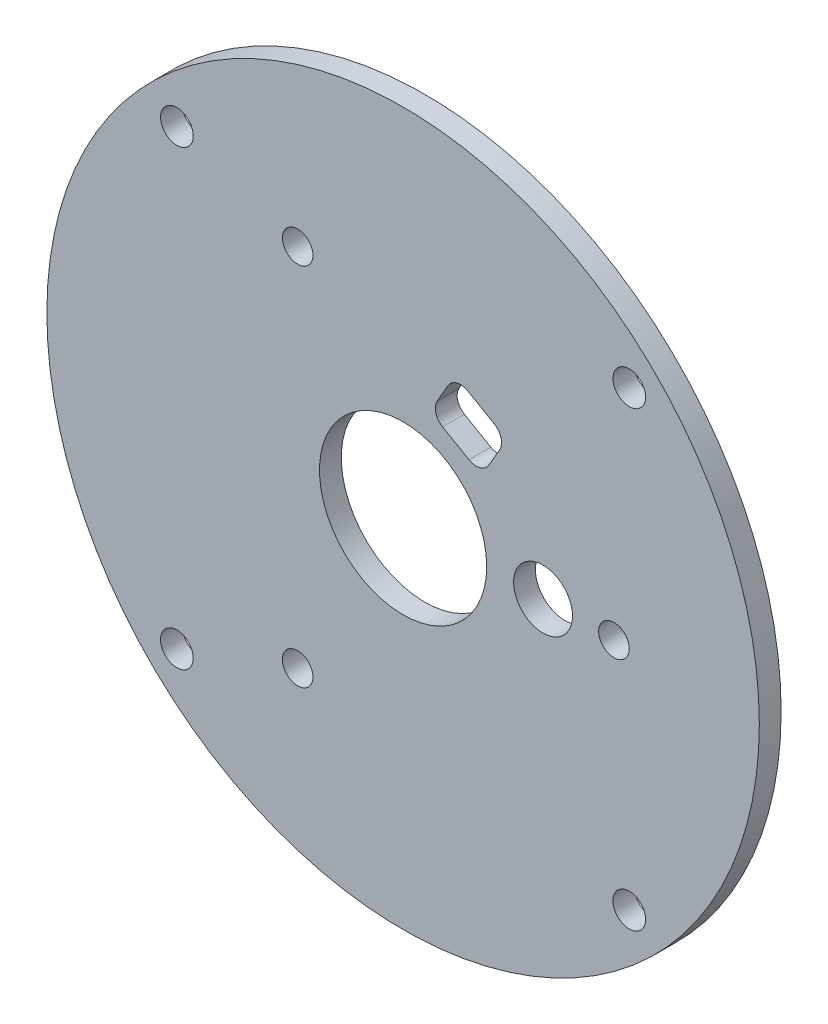
from build123d import *

# Parameters (mm, degrees)
SKETCH_1_R          = 1.6
EXTRUDE_4_DEPTH     = 13
EXTRUDE_4_2_DEPTH   = 13
EXTRUDE_4_3_DEPTH   = 13
EXTRUDE_4_4_DEPTH   = 13
SKETCH_1_R_2        = 2.1
EXTRUDE_4_5_DEPTH   = 13
EXTRUDE_4_6_DEPTH   = 13
EXTRUDE_4_7_DEPTH   = 13
SKETCH_8_R          = 49
EXTRUDE_5_DEPTH     = 3
SKETCH_9_R          = 2.1
CUT_EXTRUDE_2_DEPTH = 13
SKETCH_3_R          = 8.6
CUT_EXTRUDE_3_DEPTH = 13
SKETCH_6_R          = 4.05
CUT_EXTRUDE_4_DEPTH = 13
CUT_EXTRUDE_5_DEPTH = 13
SKETCH_2_R          = 11.5
CUT_EXTRUDE_6_DEPTH = 13
FILLET_1_R          = 2
CUT_EXTRUDE_7_REACH = 71.361
SKETCH_10_R         = 2.25
EXTRUDE_START       = -3
SKETCH_11_R         = 2.1
EXTRUDE_6_DEPTH     = 3


with BuildPart() as part:
    # 草图1 → 凸台-拉伸4 (new body)
    with BuildSketch(Plane.XY):
        with Locations((0, 44)):
            Circle(SKETCH_1_R)
    extrude(amount=EXTRUDE_4_DEPTH)



with BuildPart() as body_2:
    # 草图1 → Extrude 4 2 (new body)
    with BuildSketch(Plane.XY):
        with Locations((44, 0)):
            Circle(SKETCH_1_R)
    extrude(amount=EXTRUDE_4_2_DEPTH)


with BuildPart() as body_3:
    # 草图1 → Extrude 4 3 (new body)
    with BuildSketch(Plane.XY):
        with Locations((0, -44)):
            Circle(SKETCH_1_R)
    extrude(amount=EXTRUDE_4_3_DEPTH)


with BuildPart() as body_4:
    # 草图1 → Extrude 4 4 (new body)
    with BuildSketch(Plane.XY):
        with Locations((-44, 0)):
            Circle(SKETCH_1_R)
    extrude(amount=EXTRUDE_4_4_DEPTH)


with BuildPart() as body_5:
    # 草图1 → Extrude 4 5 (new body)
    with BuildSketch(Plane.XY):
        with Locations((29, 0)):
            Circle(SKETCH_1_R_2)
    extrude(amount=EXTRUDE_4_5_DEPTH)


with BuildPart() as body_6:
    # 草图1 → Extrude 4 6 (new body)
    with BuildSketch(Plane.XY):
        with Locations((-14.5, 25.11473671)):
            Circle(SKETCH_1_R_2)
    extrude(amount=EXTRUDE_4_6_DEPTH)


with BuildPart() as body_7:
    # 草图1 → Extrude 4 7 (new body)
    with BuildSketch(Plane.XY):
        with Locations((-14.5, -25.11473671)):
            Circle(SKETCH_1_R_2)
    extrude(amount=EXTRUDE_4_7_DEPTH)


with BuildPart() as part_1:
    add(part.part)

    add(body_2.part)  # 凸台-拉伸5 merges body 2

    add(body_3.part)  # 凸台-拉伸5 merges body 3

    add(body_4.part)  # 凸台-拉伸5 merges body 4

    add(body_5.part)  # 凸台-拉伸5 merges body 5

    add(body_6.part)  # 凸台-拉伸5 merges body 6

    add(body_7.part)  # 凸台-拉伸5 merges body 7
    # 草图8 → 凸台-拉伸5 (add)
    with BuildSketch(Plane.XY):
        Circle(SKETCH_8_R)
    extrude(amount=EXTRUDE_5_DEPTH)

    # 草图9 → 切除-拉伸2 (cut)
    with BuildSketch(Plane.XY):
        with Locations((0, 44)):
            Circle(SKETCH_9_R)
        with Locations((44, 0)):
            Circle(SKETCH_9_R)
        with Locations((0, -44)):
            Circle(SKETCH_9_R)
        with Locations((-44, 0)):
            Circle(SKETCH_9_R)
        with Locations((-14.5, 25.11473671)):
            Circle(SKETCH_9_R)
        with Locations((-14.5, -25.11473671)):
            Circle(SKETCH_9_R)
        with Locations((29, 0)):
            Circle(SKETCH_9_R)
    extrude(amount=CUT_EXTRUDE_2_DEPTH, mode=Mode.SUBTRACT)

    # 草图3 → 切除-拉伸3 (cut)
    with BuildSketch(Plane.XY):
        Circle(SKETCH_3_R)
    extrude(amount=CUT_EXTRUDE_3_DEPTH, mode=Mode.SUBTRACT)

    # 草图6 → 切除-拉伸4 (cut)
    with BuildSketch(Plane.XY):
        with Locations((19.25, 0)):
            Circle(SKETCH_6_R)
    extrude(amount=CUT_EXTRUDE_4_DEPTH, mode=Mode.SUBTRACT)

    # 草图7 → 切除-拉伸5 (cut)
    with BuildSketch(Plane.XY):
        Polygon((10.802199699, 10.505830841), (14.272482459, 16.5145615), (7.171657827, 20.615572296), (3.701375067, 14.606841637), align=None)
    extrude(amount=CUT_EXTRUDE_5_DEPTH, mode=Mode.SUBTRACT)

    # 草图2 → 切除-拉伸6 (cut)
    with BuildSketch(Plane.XY):
        Circle(SKETCH_2_R)
    extrude(amount=CUT_EXTRUDE_6_DEPTH, mode=Mode.SUBTRACT)

    # 圆角1
    fillet_1_edges = [part_1.edges().sort_by_distance(p)[0] for p in [
        (7.171657827, 20.615572296, 1.5),
        (3.701375067, 14.606841637, 1.5),
        (10.802199699, 10.505830841, 1.5),
        (14.272482459, 16.5145615, 1.5),
    ]]
    fillet(fillet_1_edges, radius=FILLET_1_R)

    # 草图10 → 切除-拉伸7 (cut, up to next)
    with BuildSketch(Plane.XY.offset(3), mode=Mode.PRIVATE) as cut_extrude_7_sk1:
        with Locations((-31.112698372, 31.112698372)):
            Circle(SKETCH_10_R)
    cut_extrude_7_tool1 = extrude(cut_extrude_7_sk1.sketch, amount=-CUT_EXTRUDE_7_REACH, mode=Mode.PRIVATE) & part_1.part
    # 草图10 → 切除-拉伸7 (cut, up to next)
    with BuildSketch(Plane.XY.offset(3), mode=Mode.PRIVATE) as cut_extrude_7_sk2:
        with Locations((31.112698372, 31.112698372)):
            Circle(SKETCH_10_R)
    cut_extrude_7_tool2 = extrude(cut_extrude_7_sk2.sketch, amount=-CUT_EXTRUDE_7_REACH, mode=Mode.PRIVATE) & part_1.part
    # 草图10 → 切除-拉伸7 (cut, up to next)
    with BuildSketch(Plane.XY.offset(3), mode=Mode.PRIVATE) as cut_extrude_7_sk3:
        with Locations((31.112698372, -31.112698372)):
            Circle(SKETCH_10_R)
    cut_extrude_7_tool3 = extrude(cut_extrude_7_sk3.sketch, amount=-CUT_EXTRUDE_7_REACH, mode=Mode.PRIVATE) & part_1.part
    # 草图10 → 切除-拉伸7 (cut, up to next)
    with BuildSketch(Plane.XY.offset(3), mode=Mode.PRIVATE) as cut_extrude_7_sk4:
        with Locations((-31.112698372, -31.112698372)):
            Circle(SKETCH_10_R)
    cut_extrude_7_tool4 = extrude(cut_extrude_7_sk4.sketch, amount=-CUT_EXTRUDE_7_REACH, mode=Mode.PRIVATE) & part_1.part
    add(cut_extrude_7_tool1.solids().sort_by_distance((-31.112698, 31.112698, 3))[0], mode=Mode.SUBTRACT)
    add(cut_extrude_7_tool2.solids().sort_by_distance((31.112698, 31.112698, 3))[0], mode=Mode.SUBTRACT)
    add(cut_extrude_7_tool3.solids().sort_by_distance((31.112698, -31.112698, 3))[0], mode=Mode.SUBTRACT)
    add(cut_extrude_7_tool4.solids().sort_by_distance((-31.112698, -31.112698, 3))[0], mode=Mode.SUBTRACT)

    # 草图11 → 凸台-拉伸6 (add)
    with BuildSketch(Plane.XY.offset(3).offset(EXTRUDE_START)):
        with Locations((-44, 0)):
            Circle(SKETCH_11_R)
        with Locations((0, -44)):
            Circle(SKETCH_11_R)
        with Locations((44, 0)):
            Circle(SKETCH_11_R)
        with Locations((0, 44)):
            Circle(SKETCH_11_R)
    extrude(amount=EXTRUDE_6_DEPTH)


solid = part_1.part
